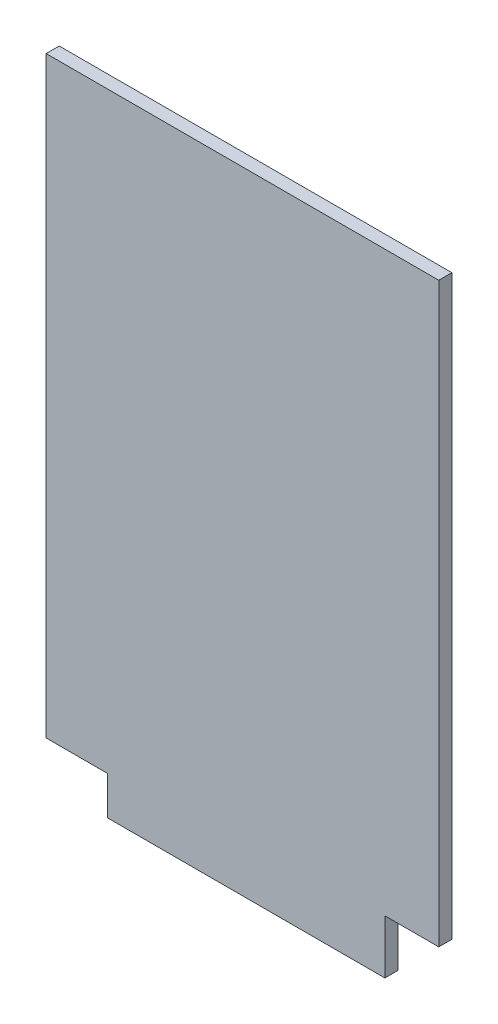
from build123d import *

# Parameters (mm, degrees)
BOSS_EXTRUDE1_DEPTH = 1.7


with BuildPart() as part:
    # Sketch1 → Boss-Extrude1 (new body)
    with BuildSketch(Plane.XY):
        Polygon((8, 0), (8, 5), (0, 5), (0, 82), (51, 82), (51, 7), (44, 7), (44, 0), align=None)
    extrude(amount=BOSS_EXTRUDE1_DEPTH)


solid = part.part
